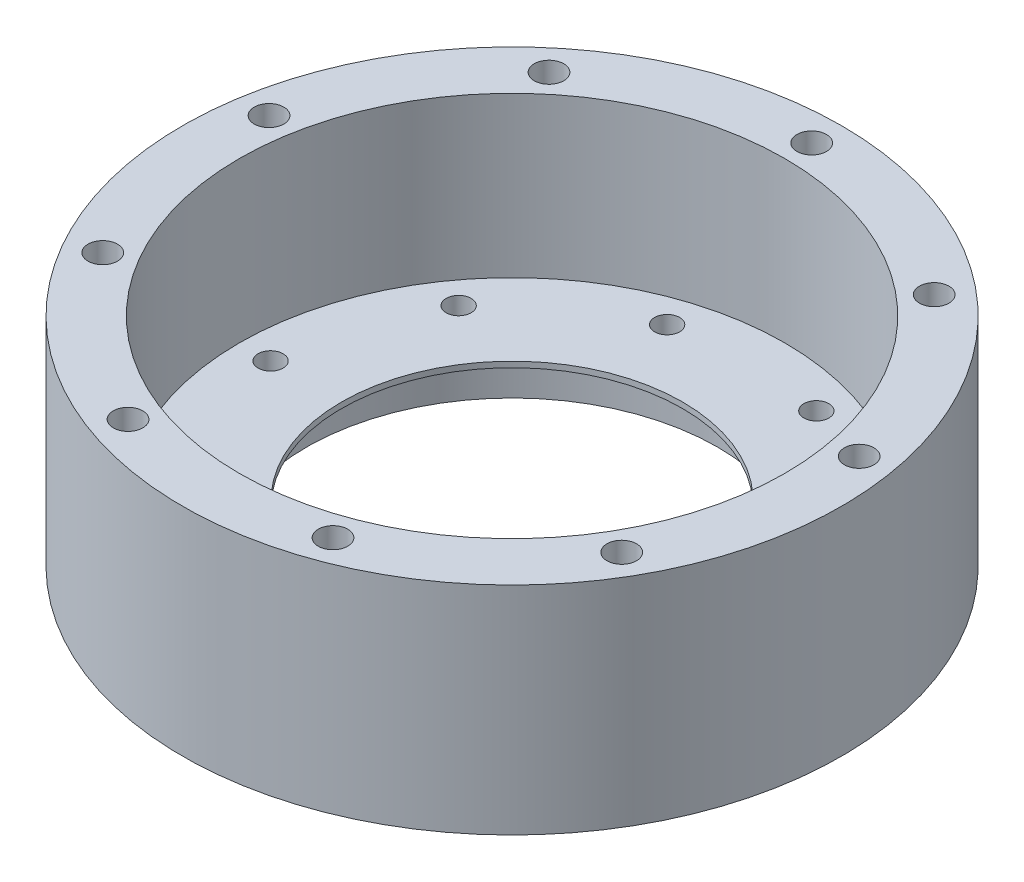
from build123d import *

# Parameters (mm, degrees)
SKETCH1_R             = 58
BOSS_EXTRUDE1_DEPTH   = 38.1
SKETCH2_R             = 48
CUT_EXTRUDE1_DEPTH    = 28.1
SKETCH5_R             = 2.6
FASTENING_HOLES_DEPTH = 91.441196365
SKETCH9_R             = 36.2
CUT_EXTRUDE2_DEPTH    = 9
SKETCH10_R            = 30
CUT_EXTRUDE3_DEPTH    = 88.033384399
SKETCH6_R             = 2.2
CUT_EXTRUDE4_DEPTH    = 91.441196365
SKETCH16_R            = 3.7
CUT_EXTRUDE5_DEPTH    = 2.2


with BuildPart() as part:
    # Sketch1 → Boss-Extrude1 (new body)
    with BuildSketch(Plane(origin=(0, 0, 0), x_dir=(1, 0, 0), z_dir=(0, 1, 0))):
        with Locations(Location((0, 0, 0), (0, 0, 90))):
            Circle(SKETCH1_R)
    extrude(amount=BOSS_EXTRUDE1_DEPTH)

    # Sketch2 → Cut-Extrude1 (cut)
    with BuildSketch(Plane(origin=(0, 38.1, 0), x_dir=(1, 0, 0), z_dir=(0, 1, 0))):
        with Locations(Location((0, 0, 0), (0, 0, 270))):
            Circle(SKETCH2_R)
    extrude(amount=-CUT_EXTRUDE1_DEPTH, mode=Mode.SUBTRACT)

    # Sketch5 → Fastening Holes (cut, through all)
    with BuildSketch(Plane(origin=(0, 38.1, 0), x_dir=(1, 0, 0), z_dir=(0, 1, 0))):
        with Locations(Location((0, 52.731846387, 0), (0, 0, 270))):
            Circle(SKETCH5_R)
        with Locations(Location((33.895377494, 40.3949379, 0), (0, 0, 270))):
            Circle(SKETCH5_R)
        with Locations(Location((51.930731153, 9.15678903, 0), (0, 0, 270))):
            Circle(SKETCH5_R)
        with Locations(Location((45.66711856, -26.365923194, 0), (0, 0, 270))):
            Circle(SKETCH5_R)
        with Locations(Location((18.035353659, -49.55172693, 0), (0, 0, 270))):
            Circle(SKETCH5_R)
        with Locations(Location((-18.035353659, -49.55172693, 0), (0, 0, 270))):
            Circle(SKETCH5_R)
        with Locations(Location((-45.66711856, -26.365923194, 0), (0, 0, 270))):
            Circle(SKETCH5_R)
        with Locations(Location((-51.930731153, 9.15678903, 0), (0, 0, 270))):
            Circle(SKETCH5_R)
        with Locations(Location((-33.895377493, 40.3949379, 0), (0, 0, 270))):
            Circle(SKETCH5_R)
    extrude(amount=-FASTENING_HOLES_DEPTH, mode=Mode.SUBTRACT)

    # Sketch9 → Cut-Extrude2 (cut)
    with BuildSketch(Plane.XZ):
        with Locations(Location((0, 0, 0), (0, 0, 270))):
            Circle(SKETCH9_R)
    extrude(amount=-CUT_EXTRUDE2_DEPTH, mode=Mode.SUBTRACT)

    # Sketch10 → Cut-Extrude3 (cut, through all)
    with BuildSketch(Plane.XZ.offset(-9)):
        with Locations(Location((0, 0, 0), (0, 0, 270))):
            Circle(SKETCH10_R)
    extrude(amount=-CUT_EXTRUDE3_DEPTH, mode=Mode.SUBTRACT)

    # Sketch6 → Cut-Extrude4 (cut, through all)
    with BuildSketch(Plane.XZ):
        with Locations(Location((13.13322, -40.419902677, 0), (0, 0, 270))):
            Circle(SKETCH6_R)
        with Locations(Location((-13.133224522, -40.419901208, 0), (0, 0, 270))):
            Circle(SKETCH6_R)
        with Locations(Location((-34.383223658, -24.980871299, 0), (0, 0, 270))):
            Circle(SKETCH6_R)
        with Locations(Location((-42.5, 2.377e-06, 0), (0, 0, 270))):
            Circle(SKETCH6_R)
        with Locations(Location((-34.383220864, 24.980875146, 0), (0, 0, 270))):
            Circle(SKETCH6_R)
        with Locations(Location((-13.13322, 40.419902677, 0), (0, 0, 270))):
            Circle(SKETCH6_R)
        with Locations(Location((13.133224522, 40.419901208, 0), (0, 0, 270))):
            Circle(SKETCH6_R)
        with Locations(Location((34.383223658, 24.980871299, 0), (0, 0, 270))):
            Circle(SKETCH6_R)
        with Locations(Location((42.5, -2.377e-06, 0), (0, 0, 270))):
            Circle(SKETCH6_R)
        with Locations(Location((34.383220864, -24.980875146, 0), (0, 0, 270))):
            Circle(SKETCH6_R)
    extrude(amount=-CUT_EXTRUDE4_DEPTH, mode=Mode.SUBTRACT)

    # Sketch16 → Cut-Extrude5 (cut)
    with BuildSketch(Plane.XZ):
        with Locations(Location((-13.13322, 40.419902677, 0), (0, 0, 270))):
            Circle(SKETCH16_R)
        with Locations(Location((13.133224522, 40.419901208, 0), (0, 0, 270))):
            Circle(SKETCH16_R)
        with Locations(Location((34.383223658, 24.980871299, 0), (0, 0, 270))):
            Circle(SKETCH16_R)
        with Locations(Location((42.5, -2.377e-06, 0), (0, 0, 270))):
            Circle(SKETCH16_R)
        with Locations(Location((34.383220864, -24.980875146, 0), (0, 0, 270))):
            Circle(SKETCH16_R)
        with Locations(Location((13.13322, -40.419902677, 0), (0, 0, 270))):
            Circle(SKETCH16_R)
        with Locations(Location((-13.133224522, -40.419901208, 0), (0, 0, 270))):
            Circle(SKETCH16_R)
        with Locations(Location((-34.383223658, -24.980871299, 0), (0, 0, 270))):
            Circle(SKETCH16_R)
        with Locations(Location((-42.5, 2.377e-06, 0), (0, 0, 270))):
            Circle(SKETCH16_R)
        with Locations(Location((-34.383220864, 24.980875146, 0), (0, 0, 270))):
            Circle(SKETCH16_R)
    extrude(amount=-CUT_EXTRUDE5_DEPTH, mode=Mode.SUBTRACT)


solid = part.part
